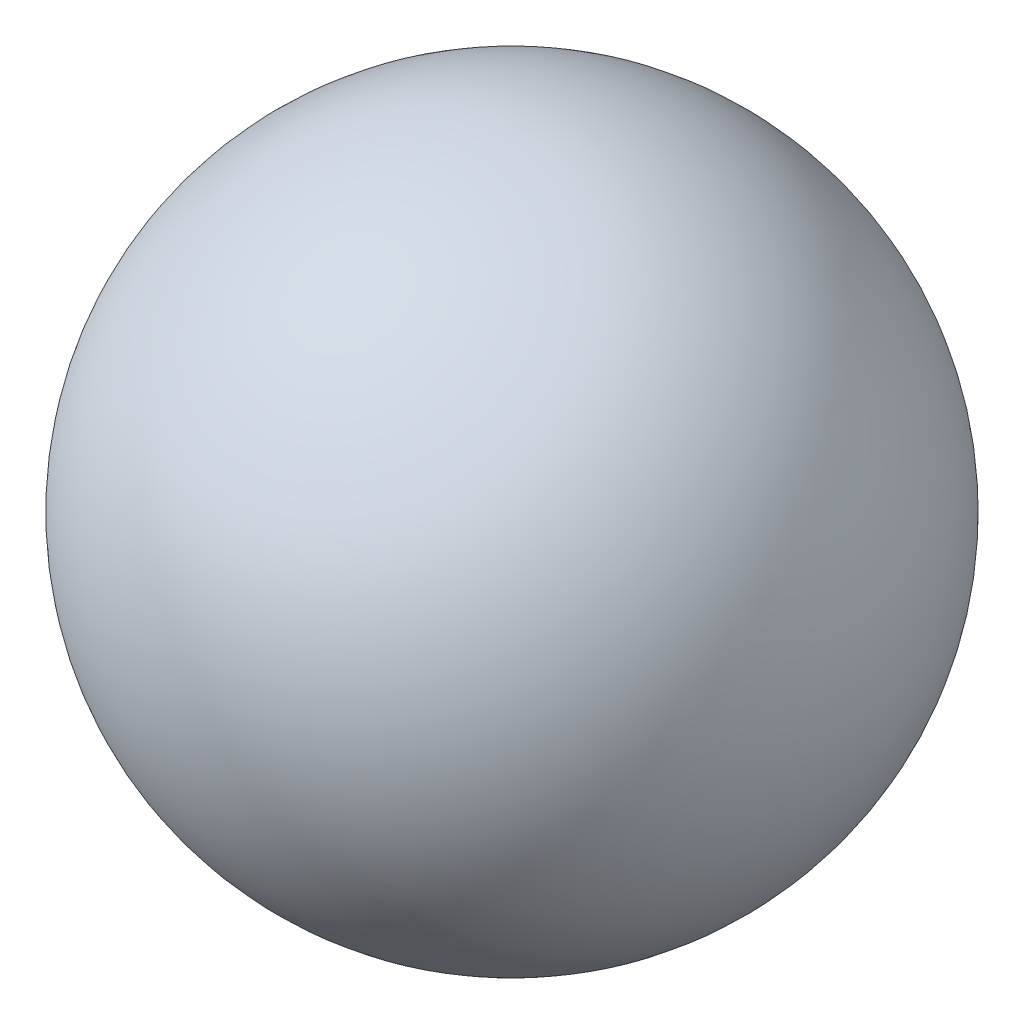
from build123d import *


with BuildPart() as part:
    # Sketch1 → Revolve1 (revolve)
    with BuildSketch(Plane.XY):
        with BuildLine():
            Line((0, -12.7), (0, 12.7))
            ThreePointArc((0, 12.7), (12.7, 0), (0, -12.7))
        make_face()
    revolve(axis=Axis((0, -12.7, 0), (0, 1, 0)))


solid = part.part
